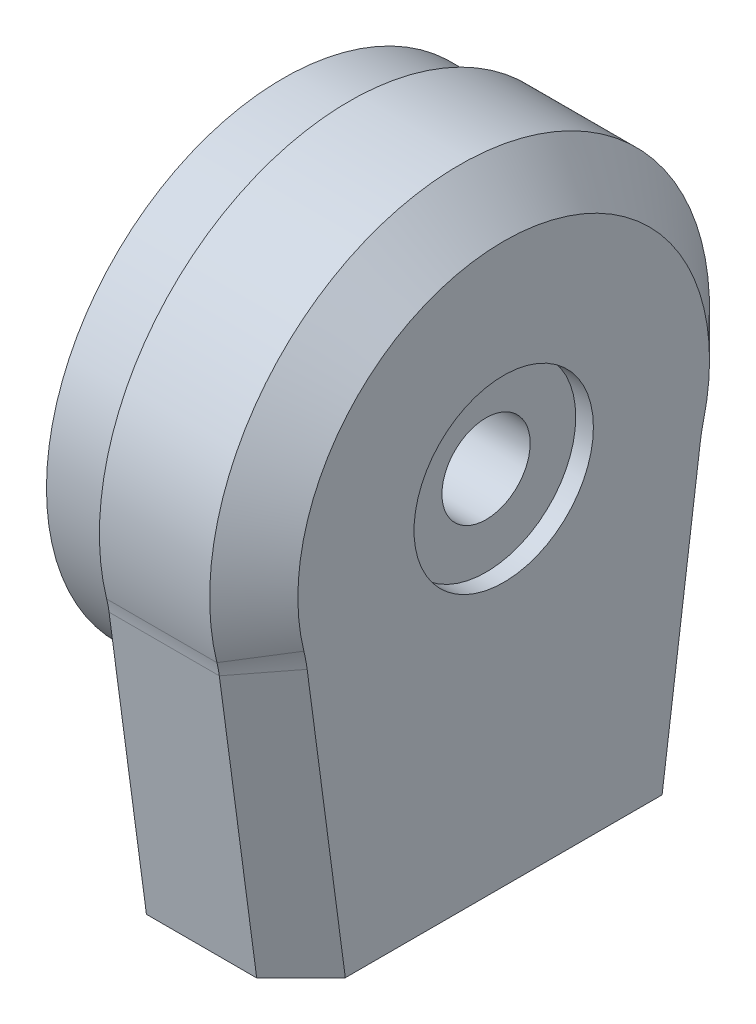
from build123d import *

# Parameters (mm, degrees)
BOSS_EXTRUDE1_START  = 65.9
BOSS_EXTRUDE1_DEPTH  = 10.5
BOSS_EXTRUDE2_START  = 65.8
BOSS_EXTRUDE2_DEPTH  = 0.6
CHAMFER1_SIZE        = 3
CHAMFER2_SIZE        = 3
BOSS_EXTRUDE3_START  = 62.7
SKETCH3_W            = 2.3
SKETCH3_H            = 23
BOSS_EXTRUDE3_DEPTH  = 6.6
BOSS_EXTRUDE4_START  = 54.5
SKETCH4_W            = 2.3
SKETCH4_H            = 6.6
BOSS_EXTRUDE4_DEPTH  = 23
BOSS_EXTRUDE5_START  = 65.9
SKETCH5_R            = 4.6
BOSS_EXTRUDE5_DEPTH  = 2.3
BOSS_EXTRUDE6_START  = 75.2
SKETCH6_R            = 6.1
BOSS_EXTRUDE6_DEPTH  = 1.7
BOSS_EXTRUDE7_START  = 68.1
SKETCH7_R            = 3
BOSS_EXTRUDE7_DEPTH  = 7.2
BOSS_EXTRUDE8_START  = 65.1
SKETCH8_W            = 6.1
SKETCH8_H            = 1.1
BOSS_EXTRUDE8_DEPTH  = 1.8
BOSS_EXTRUDE9_START  = 71.5
SKETCH9_W            = 6.1
SKETCH9_H            = 1.8
BOSS_EXTRUDE9_DEPTH  = 1.1
BOSS_EXTRUDE10_START = 65.1
SKETCH10_W           = 6.1
SKETCH10_H           = 1.1
BOSS_EXTRUDE10_DEPTH = 1.8
BOSS_EXTRUDE11_START = 59.4
SKETCH11_W           = 6.1
SKETCH11_H           = 1.8
BOSS_EXTRUDE11_DEPTH = 1.1
BOSS_EXTRUDE12_START = 65.1
SKETCH12_W           = 7.3
SKETCH12_H           = 3.4
BOSS_EXTRUDE12_DEPTH = 1.8
BOSS_EXTRUDE13_START = 72.6
SKETCH13_W           = 7.3
SKETCH13_H           = 1.8
BOSS_EXTRUDE13_DEPTH = 3.4
BOSS_EXTRUDE14_START = 65.1
SKETCH14_W           = 7.3
SKETCH14_H           = 3.4
BOSS_EXTRUDE14_DEPTH = 1.8
BOSS_EXTRUDE15_START = 56
SKETCH15_W           = 7.3
SKETCH15_H           = 1.8
BOSS_EXTRUDE15_DEPTH = 3.4
BOSS_EXTRUDE16_START = 64.4
BOSS_EXTRUDE16_DEPTH = 2.05
BOSS_EXTRUDE17_START = 61.4
SKETCH17_R           = 16.1
SKETCH17_R_2         = 15.2
BOSS_EXTRUDE17_DEPTH = 5.05
BOSS_EXTRUDE18_START = 63
SKETCH18_W           = 3.2
SKETCH18_H           = 4
BOSS_EXTRUDE18_DEPTH = 6
BOSS_EXTRUDE19_START = 26
SKETCH19_W           = 20
SKETCH19_H           = 56
BOSS_EXTRUDE19_DEPTH = 80


with BuildPart() as part:
    # Sketch1 → Boss-Extrude1 (new body)
    with BuildSketch(Plane(origin=(0, 0, 0), x_dir=(0, 0, -1), z_dir=(1, 0, 0)).offset(BOSS_EXTRUDE1_START)):
        with BuildLine():
            Line((-49.657293521, -24.929701405), (-54.04649339, -57.848700423))
            ThreePointArc((-54.04649339, -57.848700423), (-53.234221048, -59.119126346), (-52.95, -60.6))
            Line((-52.95, -60.6), (-52.95, -69.4))
            ThreePointArc((-52.95, -69.4), (-54.121572875, -72.228427125), (-56.95, -73.4))
            Line((-56.95, -73.4), (-85.85, -73.4))
            ThreePointArc((-85.85, -73.4), (-88.678427125, -72.228427125), (-89.85, -69.4))
            Line((-89.85, -69.4), (-89.85, -60.6))
            ThreePointArc((-89.85, -60.6), (-88.678427125, -57.771572875), (-85.85, -56.6))
            Line((-85.85, -56.6), (-78.12, -56.6))
            Line((-78.12, -56.6), (-82.342706479, -24.929701405))
            ThreePointArc((-82.342706479, -24.929701405), (-82.412282932, -24.49821266), (-82.505320186, -24.071167593))
            ThreePointArc((-82.505320186, -24.071167593), (-66, -3), (-49.494679814, -24.071167593))
            ThreePointArc((-49.494679814, -24.071167593), (-49.587717068, -24.49821266), (-49.657293521, -24.929701405))
        make_face()
    extrude(amount=BOSS_EXTRUDE1_DEPTH)


with BuildPart() as body_2:
    # Sketch2 → Boss-Extrude2 (new body)
    with BuildSketch(Plane(origin=(0, 0, 0), x_dir=(0, 0, -1), z_dir=(1, 0, 0)).offset(BOSS_EXTRUDE2_START)):
        with BuildLine():
            Line((-50.450275841, -24.823970429), (-54.893518409, -58.148289686))
            ThreePointArc((-54.893518409, -58.148289686), (-54.049936113, -59.247362039), (-53.75, -60.6))
            Line((-53.75, -60.6), (-53.75, -69.4))
            ThreePointArc((-53.75, -69.4), (-54.6872583, -71.6627417), (-56.95, -72.6))
            Line((-56.95, -72.6), (-85.85, -72.6))
            ThreePointArc((-85.85, -72.6), (-88.1127417, -71.6627417), (-89.05, -69.4))
            Line((-89.05, -69.4), (-89.05, -60.6))
            ThreePointArc((-89.05, -60.6), (-88.1127417, -58.3372583), (-85.85, -57.4))
            Line((-85.85, -57.4), (-77.206253549, -57.4))
            Line((-77.206253549, -57.4), (-81.549724159, -24.823970429))
            ThreePointArc((-81.549724159, -24.823970429), (-81.626258257, -24.34933281), (-81.728599236, -23.879583236))
            ThreePointArc((-81.728599236, -23.879583236), (-66, -3.8), (-50.271400764, -23.879583236))
            ThreePointArc((-50.271400764, -23.879583236), (-50.373741743, -24.34933281), (-50.450275841, -24.823970429))
        make_face()
    extrude(amount=BOSS_EXTRUDE2_DEPTH)


with BuildPart() as part_1:
    add(part.part)

    # Combine1: cut body 2
    add(body_2.part, mode=Mode.SUBTRACT)

    # Chamfer1
    chamfer1_edges = [part_1.edges().sort_by_distance(p)[0] for p in [
        (76.4, -41.389200914, 51.851893455),
        (76.4, -24.49821266, 49.587717068),
        (76.4, -24.49821266, 82.412282932),
        (76.4, -3, 66),
        (76.4, -40.764850703, 80.23135324),
    ]]
    chamfer(chamfer1_edges, length=CHAMFER1_SIZE)

    # Chamfer2
    chamfer2_edges = [part_1.edges().sort_by_distance(p)[0] for p in [
        (76.4, -56.6, 80.471725405),
        (76.4, -57.771572875, 88.678427125),
        (76.4, -57.786965833, 54.106263237),
        (76.4, -65, 89.85),
        (76.4, -65, 52.95),
        (76.4, -72.228427125, 88.678427125),
        (76.4, -72.228427125, 54.121572875),
        (76.4, -73.4, 71.4),
    ]]
    chamfer(chamfer2_edges, length=CHAMFER2_SIZE)


with BuildPart() as body_2_2:
    # Sketch3 → Boss-Extrude3 (new body)
    with BuildSketch(Plane.XY.offset(BOSS_EXTRUDE3_START)):
        with Locations((67.05, -20)):
            Rectangle(SKETCH3_W, SKETCH3_H)
    extrude(amount=BOSS_EXTRUDE3_DEPTH)


with BuildPart() as part_2:
    add(part_1.part)

    # Combine2: cut body 2 2
    add(body_2_2.part, mode=Mode.SUBTRACT)


with BuildPart() as body_2_3:
    # Sketch4 → Boss-Extrude4 (new body)
    with BuildSketch(Plane.XY.offset(BOSS_EXTRUDE4_START)):
        with Locations((67.05, -20)):
            Rectangle(SKETCH4_W, SKETCH4_H)
    extrude(amount=BOSS_EXTRUDE4_DEPTH)


with BuildPart() as part_3:
    add(part_2.part)

    # Combine3: cut body 2 3
    add(body_2_3.part, mode=Mode.SUBTRACT)


with BuildPart() as body_2_4:
    # Sketch5 → Boss-Extrude5 (new body)
    with BuildSketch(Plane(origin=(0, 0, 0), x_dir=(0, 0, -1), z_dir=(1, 0, 0)).offset(BOSS_EXTRUDE5_START)):
        with Locations((-66, -20)):
            Circle(SKETCH5_R)
    extrude(amount=BOSS_EXTRUDE5_DEPTH)


with BuildPart() as part_4:
    add(part_3.part)

    # Combine4: cut body 2 4
    add(body_2_4.part, mode=Mode.SUBTRACT)


with BuildPart() as body_2_5:
    # Sketch6 → Boss-Extrude6 (new body)
    with BuildSketch(Plane(origin=(0, 0, 0), x_dir=(0, 0, -1), z_dir=(1, 0, 0)).offset(BOSS_EXTRUDE6_START)):
        with Locations((-66, -20)):
            Circle(SKETCH6_R)
    extrude(amount=BOSS_EXTRUDE6_DEPTH)


with BuildPart() as part_5:
    add(part_4.part)

    # Combine5: cut body 2 5
    add(body_2_5.part, mode=Mode.SUBTRACT)


with BuildPart() as body_2_6:
    # Sketch7 → Boss-Extrude7 (new body)
    with BuildSketch(Plane(origin=(0, 0, 0), x_dir=(0, 0, -1), z_dir=(1, 0, 0)).offset(BOSS_EXTRUDE7_START)):
        with Locations((-66, -20)):
            Circle(SKETCH7_R)
    extrude(amount=BOSS_EXTRUDE7_DEPTH)


with BuildPart() as part_6:
    add(part_5.part)

    # Combine6: cut body 2 6
    add(body_2_6.part, mode=Mode.SUBTRACT)


with BuildPart() as body_2_7:
    # Sketch8 → Boss-Extrude8 (new body)
    with BuildSketch(Plane.XY.offset(BOSS_EXTRUDE8_START)):
        with Locations((71.15, -13.95)):
            Rectangle(SKETCH8_W, SKETCH8_H)
    extrude(amount=BOSS_EXTRUDE8_DEPTH)


with BuildPart() as part_7:
    add(part_6.part)

    # Combine7: cut body 2 7
    add(body_2_7.part, mode=Mode.SUBTRACT)


with BuildPart() as body_2_8:
    # Sketch9 → Boss-Extrude9 (new body)
    with BuildSketch(Plane.XY.offset(BOSS_EXTRUDE9_START)):
        with Locations((71.15, -20)):
            Rectangle(SKETCH9_W, SKETCH9_H)
    extrude(amount=BOSS_EXTRUDE9_DEPTH)


with BuildPart() as part_8:
    add(part_7.part)

    # Combine8: cut body 2 8
    add(body_2_8.part, mode=Mode.SUBTRACT)


with BuildPart() as body_2_9:
    # Sketch10 → Boss-Extrude10 (new body)
    with BuildSketch(Plane.XY.offset(BOSS_EXTRUDE10_START)):
        with Locations((71.15, -26.05)):
            Rectangle(SKETCH10_W, SKETCH10_H)
    extrude(amount=BOSS_EXTRUDE10_DEPTH)


with BuildPart() as part_9:
    add(part_8.part)

    # Combine9: cut body 2 9
    add(body_2_9.part, mode=Mode.SUBTRACT)


with BuildPart() as body_2_10:
    # Sketch11 → Boss-Extrude11 (new body)
    with BuildSketch(Plane.XY.offset(BOSS_EXTRUDE11_START)):
        with Locations((71.15, -20)):
            Rectangle(SKETCH11_W, SKETCH11_H)
    extrude(amount=BOSS_EXTRUDE11_DEPTH)


with BuildPart() as part_10:
    add(part_9.part)

    # Combine10: cut body 2 10
    add(body_2_10.part, mode=Mode.SUBTRACT)


with BuildPart() as body_2_11:
    # Sketch12 → Boss-Extrude12 (new body)
    with BuildSketch(Plane.XY.offset(BOSS_EXTRUDE12_START)):
        with Locations((71.75, -11.7)):
            Rectangle(SKETCH12_W, SKETCH12_H)
    extrude(amount=BOSS_EXTRUDE12_DEPTH)


with BuildPart() as part_11:
    add(part_10.part)

    # Combine11: cut body 2 11
    add(body_2_11.part, mode=Mode.SUBTRACT)


with BuildPart() as body_2_12:
    # Sketch13 → Boss-Extrude13 (new body)
    with BuildSketch(Plane.XY.offset(BOSS_EXTRUDE13_START)):
        with Locations((71.75, -20)):
            Rectangle(SKETCH13_W, SKETCH13_H)
    extrude(amount=BOSS_EXTRUDE13_DEPTH)


with BuildPart() as part_12:
    add(part_11.part)

    # Combine12: cut body 2 12
    add(body_2_12.part, mode=Mode.SUBTRACT)


with BuildPart() as body_2_13:
    # Sketch14 → Boss-Extrude14 (new body)
    with BuildSketch(Plane.XY.offset(BOSS_EXTRUDE14_START)):
        with Locations((71.75, -28.3)):
            Rectangle(SKETCH14_W, SKETCH14_H)
    extrude(amount=BOSS_EXTRUDE14_DEPTH)


with BuildPart() as part_13:
    add(part_12.part)

    # Combine13: cut body 2 13
    add(body_2_13.part, mode=Mode.SUBTRACT)


with BuildPart() as body_2_14:
    # Sketch15 → Boss-Extrude15 (new body)
    with BuildSketch(Plane.XY.offset(BOSS_EXTRUDE15_START)):
        with Locations((71.75, -20)):
            Rectangle(SKETCH15_W, SKETCH15_H)
    extrude(amount=BOSS_EXTRUDE15_DEPTH)


with BuildPart() as part_14:
    add(part_13.part)

    # Combine14: cut body 2 14
    add(body_2_14.part, mode=Mode.SUBTRACT)

    # Sketch16 → Boss-Extrude16 (add)
    with BuildSketch(Plane(origin=(0, 0, 0), x_dir=(0, 0, -1), z_dir=(1, 0, 0)).offset(BOSS_EXTRUDE16_START)):
        with BuildLine():
            Line((-51.904610688, -14.86969785), (-52.468426261, -15.074909936))
            ThreePointArc((-52.468426261, -15.074909936), (-66, -5.6), (-79.531573739, -15.074909936))
            Line((-79.531573739, -15.074909936), (-80.095389312, -14.86969785))
            ThreePointArc((-80.095389312, -14.86969785), (-66, -5), (-51.904610688, -14.86969785))
        make_face()
    extrude(amount=BOSS_EXTRUDE16_DEPTH)

    # Sketch17 → Boss-Extrude17 (add)
    with BuildSketch(Plane(origin=(0, 0, 0), x_dir=(0, 0, -1), z_dir=(1, 0, 0)).offset(BOSS_EXTRUDE17_START)):
        with Locations((-66, -20)):
            Circle(SKETCH17_R)
        with Locations((-66, -20)):
            Circle(SKETCH17_R_2, mode=Mode.SUBTRACT)
    extrude(amount=BOSS_EXTRUDE17_DEPTH)


with BuildPart() as body_2_15:
    # Sketch18 → Boss-Extrude18 (new body)
    with BuildSketch(Plane.XY.offset(BOSS_EXTRUDE18_START)):
        with Locations((64.8, -36)):
            Rectangle(SKETCH18_W, SKETCH18_H)
    extrude(amount=BOSS_EXTRUDE18_DEPTH)


with BuildPart() as part_15:
    add(part_14.part)

    # Combine15: cut body 2 15
    add(body_2_15.part, mode=Mode.SUBTRACT)


with BuildPart() as body_2_16:
    # Sketch19 → Boss-Extrude19 (new body)
    with BuildSketch(Plane.XY.offset(BOSS_EXTRUDE19_START)):
        with Locations((70, -72)):
            Rectangle(SKETCH19_W, SKETCH19_H)
    extrude(amount=BOSS_EXTRUDE19_DEPTH)


with BuildPart() as part_16:
    add(part_15.part)

    # Combine16: cut body 2 16
    add(body_2_16.part, mode=Mode.SUBTRACT)


solid = part_16.part
